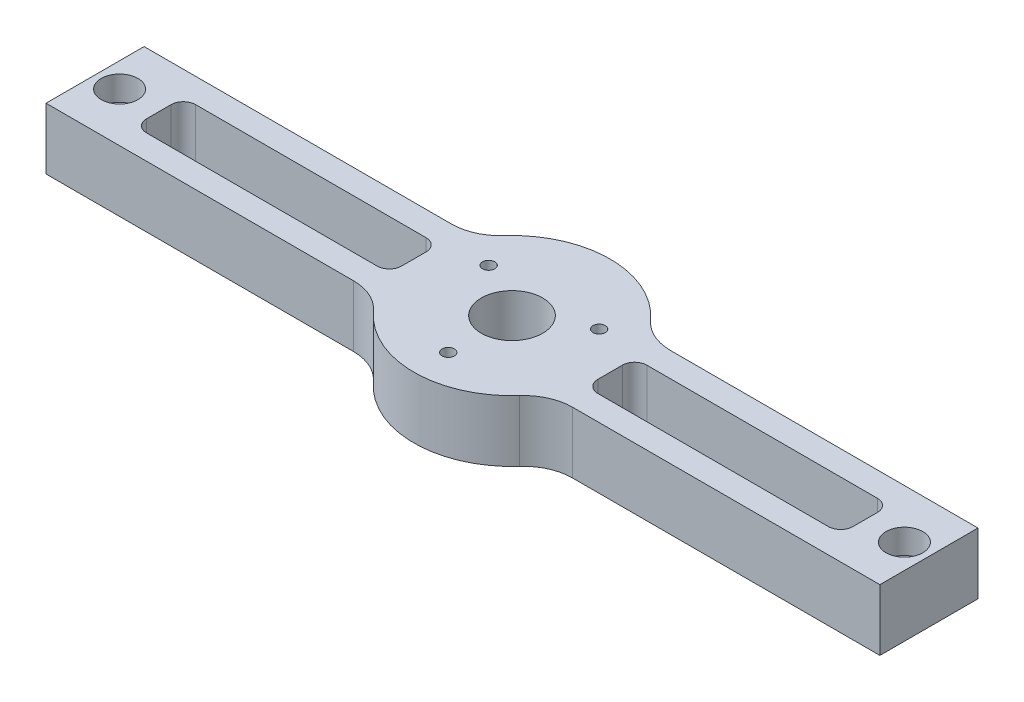
from build123d import *

# Parameters (mm, degrees)
SKETCH2_R           = 7.9375
BOSS_EXTRUDE1_DEPTH = 15.875
FILLET1_R           = 12.7
SKETCH3_R           = 22.225
CUT_EXTRUDE1_DEPTH  = 3.175
SKETCH4_R           = 4.7625
CUT_EXTRUDE2_DEPTH  = 6.35
SKETCH5_R           = 3.175
CUT_EXTRUDE3_DEPTH  = 115.871833471
SKETCH6_R           = 1.5875
CUT_EXTRUDE4_DEPTH  = 116.178567885
SKETCH7_W           = 66.04
SKETCH7_H           = 12.7
CUT_EXTRUDE5_DEPTH  = 116.571744492
FILLET2_R           = 3.175


with BuildPart() as part:
    # Sketch2 → Boss-Extrude1 (new body)
    # profile 1 of 5: a face of its own
    with BuildSketch(Plane(origin=(0, 0, 0), x_dir=(1, 0, 0), z_dir=(0, 1, 0))):
        with BuildLine():
            Line((-107.95, 0), (-107.95, -25.4))
            Line((-107.95, -25.4), (-21.997045256, -25.4))
            ThreePointArc((-21.997045256, -25.4), (-25.4, -12.7), (-21.997045256, 0))
            Line((-21.997045256, 0), (-107.95, 0))
        make_face()
    # profile 2 of 5: a face of its own
    with BuildSketch(Plane(origin=(0, 0, 0), x_dir=(1, 0, 0), z_dir=(0, 1, 0))):
        with BuildLine():
            ThreePointArc((-21.997045256, 0), (-25.4, -12.7), (-21.997045256, -25.4))
            Line((-21.997045256, -25.4), (-21.997045256, 0))
        make_face()
    # profile 3 of 5: a face of its own
    with BuildSketch(Plane(origin=(0, 0, 0), x_dir=(1, 0, 0), z_dir=(0, 1, 0))):
        with BuildLine():
            Line((-21.997045256, 0), (-21.997045256, -25.4))
            ThreePointArc((-21.997045256, -25.4), (0, -38.1), (21.997045256, -25.4))
            Line((21.997045256, -25.4), (21.997045256, 0))
            ThreePointArc((21.997045256, 0), (0, 12.7), (-21.997045256, 0))
        make_face()
        with Locations(Location((0, -12.7, 0), (0, 0, 270))):
            Circle(SKETCH2_R, mode=Mode.SUBTRACT)
    # profile 4 of 5: a face of its own
    with BuildSketch(Plane(origin=(0, 0, 0), x_dir=(1, 0, 0), z_dir=(0, 1, 0))):
        with BuildLine():
            Line((21.997045256, 0), (21.997045256, -25.4))
            ThreePointArc((21.997045256, -25.4), (24.534515988, -19.274003746), (25.4, -12.7))
            ThreePointArc((25.4, -12.7), (24.534515988, -6.125996254), (21.997045256, 0))
        make_face()
    # profile 5 of 5: a face of its own
    with BuildSketch(Plane(origin=(0, 0, 0), x_dir=(1, 0, 0), z_dir=(0, 1, 0))):
        with BuildLine():
            ThreePointArc((25.4, -12.7), (24.534515988, -19.274003746), (21.997045256, -25.4))
            Line((21.997045256, -25.4), (107.95, -25.4))
            Line((107.95, -25.4), (107.95, 0))
            Line((107.95, 0), (21.997045256, 0))
            ThreePointArc((21.997045256, 0), (24.534515988, -6.125996254), (25.4, -12.7))
        make_face()
    extrude(amount=BOSS_EXTRUDE1_DEPTH)

    # Fillet1
    fillet1_edges = [part.edges().sort_by_distance(p)[0] for p in [
        (-21.997045256, 7.9375, 0),
        (21.997045256, 7.9375, 0),
        (21.997045256, 7.9375, 25.4),
        (-21.997045256, 7.9375, 25.4),
    ]]
    fillet(fillet1_edges, radius=FILLET1_R)

    # Sketch3 → Cut-Extrude1 (cut)
    with BuildSketch(Plane.XZ):
        with Locations(Location((0, 12.7, 0), (0, 0, 270))):
            Circle(SKETCH3_R)
    extrude(amount=-CUT_EXTRUDE1_DEPTH, mode=Mode.SUBTRACT)

    # Sketch4 → Cut-Extrude2 (cut)
    with BuildSketch(Plane(origin=(0, 15.875, 0), x_dir=(1, 0, 0), z_dir=(0, 1, 0))):
        with Locations(Location((-101.6, -12.7, 0), (0, 0, 270))):
            Circle(SKETCH4_R)
        with Locations(Location((101.6, -12.7, 0), (0, 0, 270))):
            Circle(SKETCH4_R)
    extrude(amount=-CUT_EXTRUDE2_DEPTH, mode=Mode.SUBTRACT)

    # Sketch5 → Cut-Extrude3 (cut, through all)
    with BuildSketch(Plane(origin=(0, 9.525, 0), x_dir=(1, 0, 0), z_dir=(0, 1, 0))):
        with Locations(Location((-101.6, -12.7, 0), (0, 0, 270))):
            Circle(SKETCH5_R)
        with Locations(Location((101.6, -12.7, 0), (0, 0, 270))):
            Circle(SKETCH5_R)
    extrude(amount=-CUT_EXTRUDE3_DEPTH, mode=Mode.SUBTRACT)

    # Sketch6 → Cut-Extrude4 (cut, through all)
    with BuildSketch(Plane.XZ.offset(-3.175)):
        with Locations(Location((0, 29.21, 0), (0, 0, 270))):
            Circle(SKETCH6_R)
        with Locations(Location((14.298079416, 4.445, 0), (0, 0, 270))):
            Circle(SKETCH6_R)
        with Locations(Location((-14.298079416, 4.445, 0), (0, 0, 270))):
            Circle(SKETCH6_R)
    extrude(amount=-CUT_EXTRUDE4_DEPTH, mode=Mode.SUBTRACT)

    # Sketch7 → Cut-Extrude5 (cut, through all)
    with BuildSketch(Plane(origin=(0, 15.875, 0), x_dir=(1, 0, 0), z_dir=(0, 1, 0))):
        with Locations((-58.42, -12.7)):
            Rectangle(SKETCH7_W, SKETCH7_H)
        with Locations((58.42, -12.7)):
            Rectangle(SKETCH7_W, SKETCH7_H)
    extrude(amount=-CUT_EXTRUDE5_DEPTH, mode=Mode.SUBTRACT)

    # Fillet2
    fillet2_edges = [part.edges().sort_by_distance(p)[0] for p in [
        (-91.44, 7.9375, 19.05),
        (-91.44, 7.9375, 6.35),
        (-25.4, 7.9375, 6.35),
        (-25.4, 7.9375, 19.05),
        (25.4, 7.9375, 19.05),
        (25.4, 7.9375, 6.35),
        (91.44, 7.9375, 6.35),
        (91.44, 7.9375, 19.05),
    ]]
    fillet(fillet2_edges, radius=FILLET2_R)


solid = part.part
